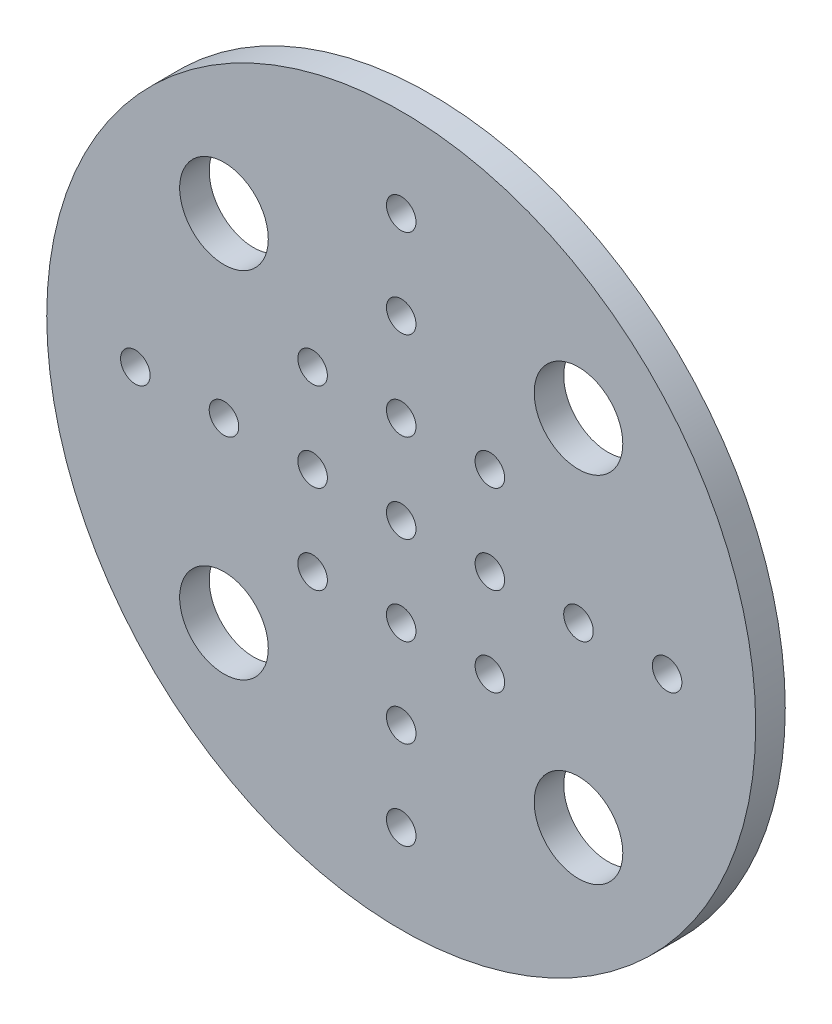
from build123d import *

# Parameters (mm, degrees)
MODEL_R                 = 36
MODEL_R_2               = 4.5
MODEL_R_3               = 1.5
SALIENTE_EXTRUIR1_DEPTH = 3


with BuildPart() as part:
    # Model → Saliente-Extruir1 (new body)
    with BuildSketch(Plane.XY):
        with Locations((225.25945398, 284.786767066)):
            Circle(MODEL_R)
        with Locations((207.25945398, 302.786767066)):
            Circle(MODEL_R_2, mode=Mode.SUBTRACT)
        with Locations((207.25945398, 266.786767066)):
            Circle(MODEL_R_2, mode=Mode.SUBTRACT)
        with Locations((243.25945398, 266.786767066)):
            Circle(MODEL_R_2, mode=Mode.SUBTRACT)
        with Locations((243.25945398, 302.786767066)):
            Circle(MODEL_R_2, mode=Mode.SUBTRACT)
        with Locations((225.25945398, 284.786767066)):
            Circle(MODEL_R_3, mode=Mode.SUBTRACT)
        with Locations((225.25945398, 275.786767066)):
            Circle(MODEL_R_3, mode=Mode.SUBTRACT)
        with Locations((225.25945398, 293.786767066)):
            Circle(MODEL_R_3, mode=Mode.SUBTRACT)
        with Locations((234.25945398, 284.786767066)):
            Circle(MODEL_R_3, mode=Mode.SUBTRACT)
        with Locations((216.25945398, 284.786767066)):
            Circle(MODEL_R_3, mode=Mode.SUBTRACT)
        with Locations((243.25945398, 284.786767066)):
            Circle(MODEL_R_3, mode=Mode.SUBTRACT)
        with Locations((252.25945398, 284.786767066)):
            Circle(MODEL_R_3, mode=Mode.SUBTRACT)
        with Locations((198.25945398, 284.786767066)):
            Circle(MODEL_R_3, mode=Mode.SUBTRACT)
        with Locations((207.25945398, 284.786767066)):
            Circle(MODEL_R_3, mode=Mode.SUBTRACT)
        with Locations((225.25945398, 302.786767066)):
            Circle(MODEL_R_3, mode=Mode.SUBTRACT)
        with Locations((225.25945398, 311.786767066)):
            Circle(MODEL_R_3, mode=Mode.SUBTRACT)
        with Locations((225.25945398, 266.786767066)):
            Circle(MODEL_R_3, mode=Mode.SUBTRACT)
        with Locations((225.25945398, 257.786767066)):
            Circle(MODEL_R_3, mode=Mode.SUBTRACT)
        with Locations((216.25945398, 275.786767066)):
            Circle(MODEL_R_3, mode=Mode.SUBTRACT)
        with Locations((234.25945398, 293.786767066)):
            Circle(MODEL_R_3, mode=Mode.SUBTRACT)
        with Locations((234.25945398, 275.786767066)):
            Circle(MODEL_R_3, mode=Mode.SUBTRACT)
        with Locations((216.25945398, 293.786767066)):
            Circle(MODEL_R_3, mode=Mode.SUBTRACT)
    extrude(amount=SALIENTE_EXTRUIR1_DEPTH)


solid = part.part
